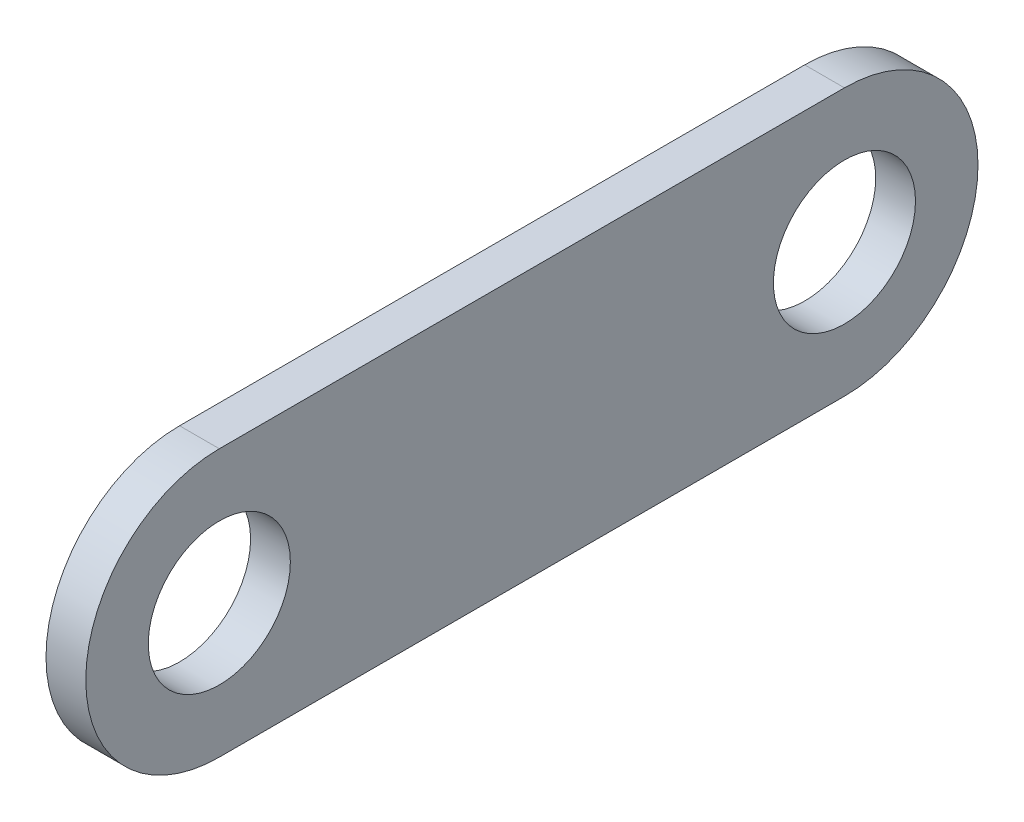
from build123d import *

# Parameters (mm, degrees)
SKETCH1_R           = 1.27
BOSS_EXTRUDE1_DEPTH = 0.7112


with BuildPart() as part:
    # Sketch1 → Boss-Extrude1 (new body)
    with BuildSketch(Plane(origin=(0, 0, 0), x_dir=(0, 0, -1), z_dir=(1, 0, 0))):
        with BuildLine():
            Line((-5.588, 2.3876), (5.588, 2.3876))
            ThreePointArc((5.588, 2.3876), (7.9756, 0), (5.588, -2.3876))
            Line((5.588, -2.3876), (-5.588, -2.3876))
            ThreePointArc((-5.588, -2.3876), (-7.9756, 0), (-5.588, 2.3876))
        make_face()
        with Locations((5.588, 0)):
            Circle(SKETCH1_R, mode=Mode.SUBTRACT)
        with Locations((-5.588, 0)):
            Circle(SKETCH1_R, mode=Mode.SUBTRACT)
    extrude(amount=BOSS_EXTRUDE1_DEPTH)


solid = part.part
